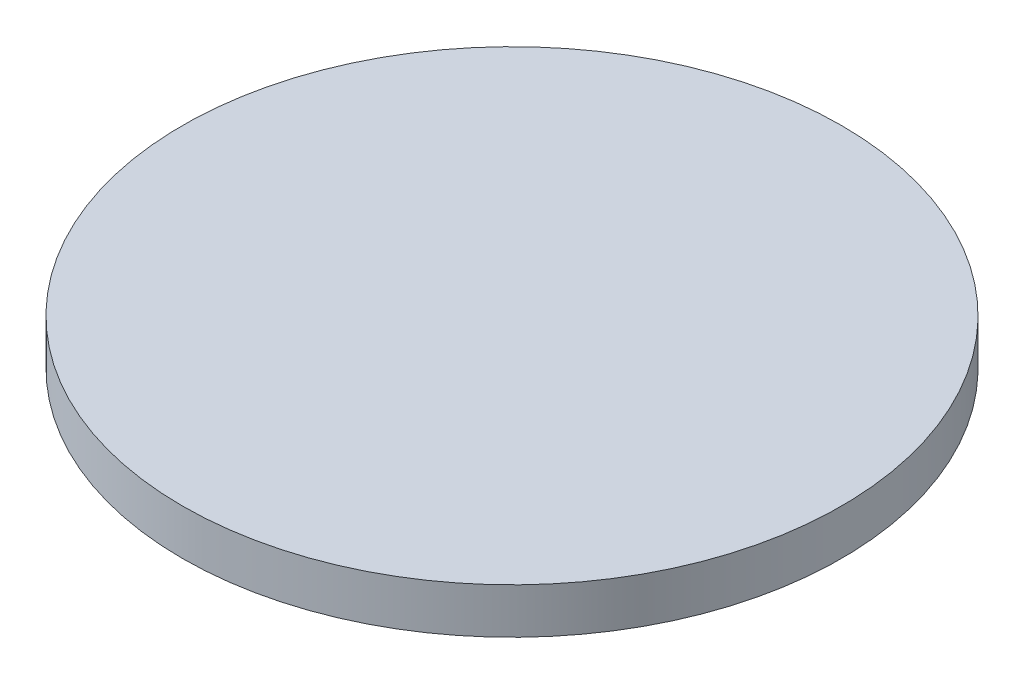
from build123d import *

# Parameters (mm, degrees)
SKETCH1_W           = 127.635
SKETCH1_H           = 127.635
BOSS_EXTRUDE1_DEPTH = 9.525
SKETCH13_R          = 92.075
BOSS_EXTRUDE2_DEPTH = 12.7


with BuildPart() as part:
    # Sketch1 → Boss-Extrude1 (new body)
    with BuildSketch(Plane(origin=(0, 0, 0), x_dir=(1, 0, 0), z_dir=(0, 1, 0))):
        with Locations((63.8175, 63.8175)):
            Rectangle(SKETCH1_W, SKETCH1_H)
    extrude(amount=BOSS_EXTRUDE1_DEPTH)

    # Sketch13 → Boss-Extrude2 (add)
    with BuildSketch(Plane(origin=(0, 9.525, 0), x_dir=(1, 0, 0), z_dir=(0, 1, 0))):
        with Locations(Location((63.8175, 63.8175, 0), (0, 0, 270))):
            Circle(SKETCH13_R)
    extrude(amount=-BOSS_EXTRUDE2_DEPTH)


solid = part.part
